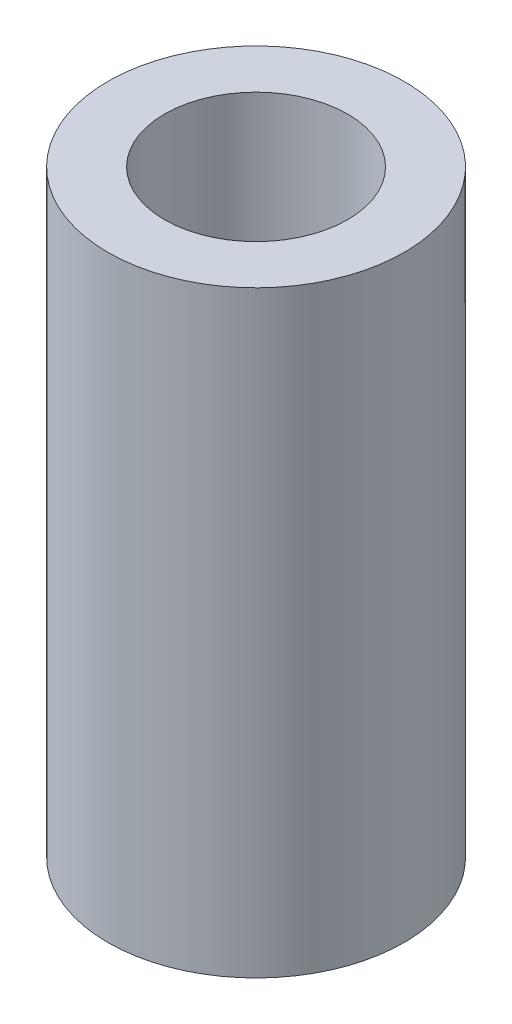
from build123d import *

# Parameters (mm, degrees)
SKETCH1_R           = 5.2375
SKETCH1_R_2         = 3.2375
BOSS_EXTRUDE1_DEPTH = 21.1346


with BuildPart() as part:
    # Sketch1 → Boss-Extrude1 (new body)
    with BuildSketch(Plane(origin=(0, 0, 0), x_dir=(1, 0, 0), z_dir=(0, 1, 0))):
        with Locations(Location((0, 0, 0), (0, 0, 270))):
            Circle(SKETCH1_R)
        with Locations(Location((0, 0, 0), (0, 0, 270))):
            Circle(SKETCH1_R_2, mode=Mode.SUBTRACT)
    extrude(amount=BOSS_EXTRUDE1_DEPTH)


solid = part.part
